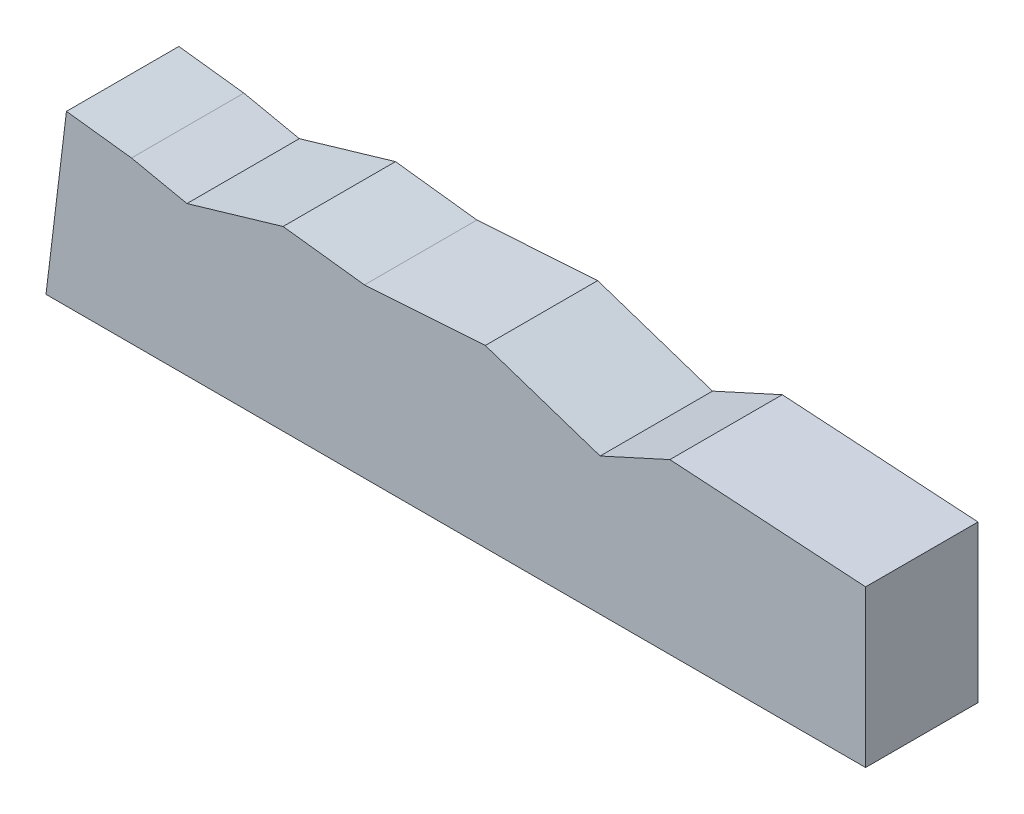
from build123d import *

# Parameters (mm, degrees)
BOSS_EXTRUDE1_DEPTH = 25


with BuildPart() as part:
    # Sketch1 → Boss-Extrude1 (new, symmetric)
    with BuildSketch(Plane.XY):
        Polygon((174.222136922, -57.238128372), (87.15683818, -51.742312172), (56.135286368, -65.87093973), (5.042318242, -48.839950355), (-48.693389614, -52.363603329), (-84.909116911, -47.973818202), (-127.676365392, -60.518877757), (-152.347514605, -55.299980807), (-181.277343289, -51.793334906), (-190.375943184, -126.856784041), (174.222136922, -126.856784041), align=None)
    extrude(amount=BOSS_EXTRUDE1_DEPTH, both=True)


solid = part.part
